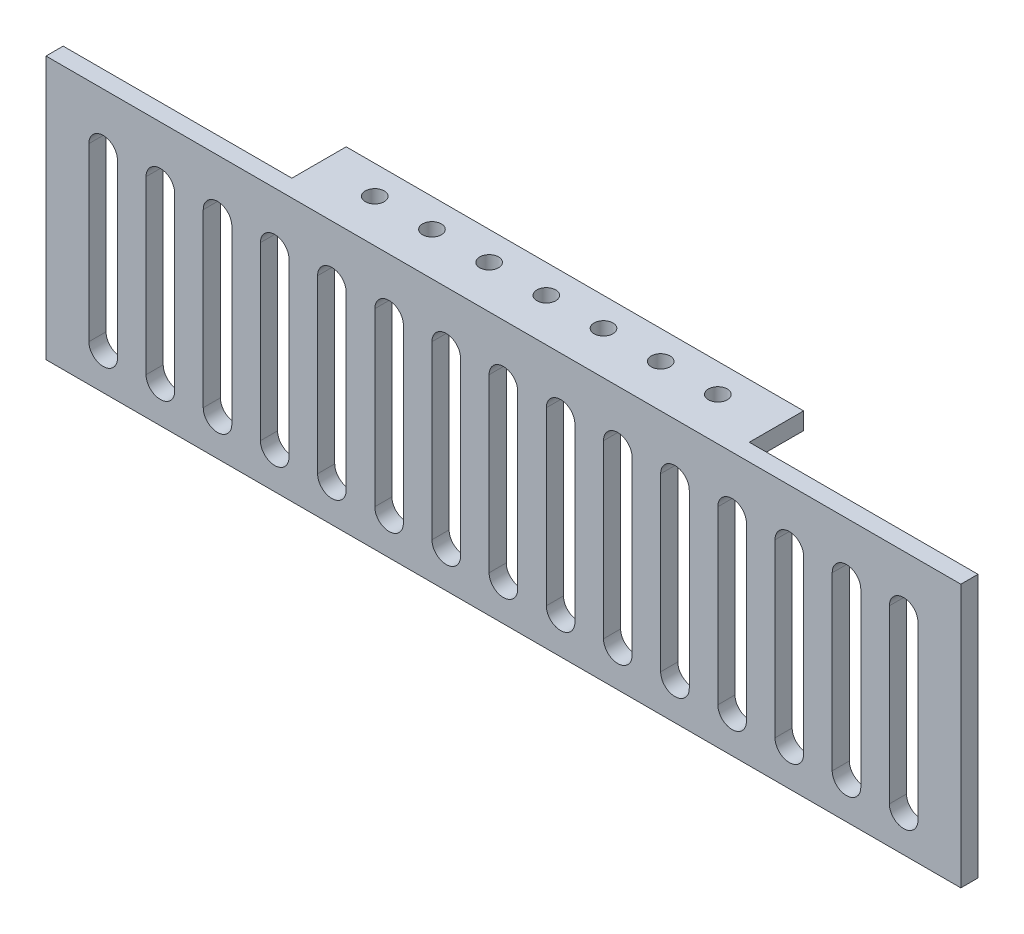
from build123d import *

# Parameters (mm, degrees)
SKETCH_1_W          = 80
SKETCH_1_H          = 15
EXTRUDE_1_DEPTH     = 3
SKETCH_2_R          = 1.65
CUT_EXTRUDE_1_DEPTH = 3
SKETCH_3_W          = 80
SKETCH_3_H          = 3
EXTRUDE_2_DEPTH     = 43
SKETCH_4_W          = 3
SKETCH_4_H          = 46
EXTRUDE_3_DEPTH     = 40
SKETCH_5_W          = 3
SKETCH_5_H          = 46
EXTRUDE_4_DEPTH     = 40
SKETCH_8_W          = 2.5
SKETCH_8_H          = 3
CUT_EXTRUDE_3_DEPTH = 80
CUT_EXTRUDE_4_DEPTH = 80


with BuildPart() as part:
    # 草图1 → 凸台-拉伸1 (new body)
    with BuildSketch(Plane(origin=(0, 0, 0), x_dir=(1, 0, 0), z_dir=(0, 1, 0))):
        Rectangle(SKETCH_1_W, SKETCH_1_H)
    extrude(amount=EXTRUDE_1_DEPTH)

    # 草图2 → 切除-拉伸1 (cut)
    with BuildSketch(Plane(origin=(0, 3, 0), x_dir=(1, 0, 0), z_dir=(0, 1, 0))):
        with Locations(Location((-30, 2.5, 0), (0, 0, 270))):
            Circle(SKETCH_2_R)
        with Locations(Location((-20, 2.5, 0), (0, 0, 270))):
            Circle(SKETCH_2_R)
        with Locations(Location((-10, 2.5, 0), (0, 0, 270))):
            Circle(SKETCH_2_R)
        with Locations(Location((0, 2.5, 0), (0, 0, 270))):
            Circle(SKETCH_2_R)
        with Locations(Location((10, 2.5, 0), (0, 0, 270))):
            Circle(SKETCH_2_R)
        with Locations(Location((20, 2.5, 0), (0, 0, 270))):
            Circle(SKETCH_2_R)
        with Locations(Location((30, 2.5, 0), (0, 0, 270))):
            Circle(SKETCH_2_R)
    extrude(amount=-CUT_EXTRUDE_1_DEPTH, mode=Mode.SUBTRACT)

    # 草图3 → 凸台-拉伸2 (add)
    with BuildSketch(Plane.XZ):
        with Locations((0, 3.5)):
            Rectangle(SKETCH_3_W, SKETCH_3_H)
    extrude(amount=EXTRUDE_2_DEPTH)

    # 草图4 → 凸台-拉伸3 (add)
    with BuildSketch(Plane(origin=(40, 0, 0), x_dir=(0, 0, -1), z_dir=(1, 0, 0))):
        with Locations((-3.5, -20)):
            Rectangle(SKETCH_4_W, SKETCH_4_H)
    extrude(amount=EXTRUDE_3_DEPTH)

    # 草图5 → 凸台-拉伸4 (add)
    with BuildSketch(Plane.ZY.offset(40)):
        with Locations((3.5, -20)):
            Rectangle(SKETCH_5_W, SKETCH_5_H)
    extrude(amount=EXTRUDE_4_DEPTH)

    # 草图8 → 切除-拉伸3 (cut)
    with BuildSketch(Plane.ZY.offset(40)):
        with Locations((6.25, 1.5)):
            Rectangle(SKETCH_8_W, SKETCH_8_H)
    extrude(amount=-CUT_EXTRUDE_3_DEPTH, mode=Mode.SUBTRACT)

    # 草图9 → 切除-拉伸4 (cut)
    with BuildSketch(Plane(origin=(0, 0, 2), x_dir=(-1, 0, 0), z_dir=(0, 0, -1))):
        with BuildLine():
            Line((-67.5, -6.520841628), (-67.5, -36.520841628))
            ThreePointArc((-67.5, -36.520841628), (-70, -39.020841628), (-72.5, -36.520841628))
            Line((-72.5, -36.520841628), (-72.5, -6.520841628))
            ThreePointArc((-72.5, -6.520841628), (-70, -4.020841628), (-67.5, -6.520841628))
        make_face()
        with BuildLine():
            Line((-57.5, -6.520841628), (-57.5, -36.520841628))
            ThreePointArc((-57.5, -36.520841628), (-60, -39.020841628), (-62.5, -36.520841628))
            Line((-62.5, -36.520841628), (-62.5, -6.520841628))
            ThreePointArc((-62.5, -6.520841628), (-60, -4.020841628), (-57.5, -6.520841628))
        make_face()
        with BuildLine():
            Line((-47.5, -6.520841628), (-47.5, -36.520841628))
            ThreePointArc((-47.5, -36.520841628), (-50, -39.020841628), (-52.5, -36.520841628))
            Line((-52.5, -36.520841628), (-52.5, -6.520841628))
            ThreePointArc((-52.5, -6.520841628), (-50, -4.020841628), (-47.5, -6.520841628))
        make_face()
        with BuildLine():
            Line((-37.5, -6.520841628), (-37.5, -36.520841628))
            ThreePointArc((-37.5, -36.520841628), (-40, -39.020841628), (-42.5, -36.520841628))
            Line((-42.5, -36.520841628), (-42.5, -6.520841628))
            ThreePointArc((-42.5, -6.520841628), (-40, -4.020841628), (-37.5, -6.520841628))
        make_face()
        with BuildLine():
            Line((-27.5, -6.520841628), (-27.5, -36.520841628))
            ThreePointArc((-27.5, -36.520841628), (-30, -39.020841628), (-32.5, -36.520841628))
            Line((-32.5, -36.520841628), (-32.5, -6.520841628))
            ThreePointArc((-32.5, -6.520841628), (-30, -4.020841628), (-27.5, -6.520841628))
        make_face()
        with BuildLine():
            Line((-17.5, -6.520841628), (-17.5, -36.520841628))
            ThreePointArc((-17.5, -36.520841628), (-20, -39.020841628), (-22.5, -36.520841628))
            Line((-22.5, -36.520841628), (-22.5, -6.520841628))
            ThreePointArc((-22.5, -6.520841628), (-20, -4.020841628), (-17.5, -6.520841628))
        make_face()
        with BuildLine():
            Line((-7.5, -6.520841628), (-7.5, -36.520841628))
            ThreePointArc((-7.5, -36.520841628), (-10, -39.020841628), (-12.5, -36.520841628))
            Line((-12.5, -36.520841628), (-12.5, -6.520841628))
            ThreePointArc((-12.5, -6.520841628), (-10, -4.020841628), (-7.5, -6.520841628))
        make_face()
        with BuildLine():
            Line((2.5, -6.520841628), (2.5, -36.520841628))
            ThreePointArc((2.5, -36.520841628), (0, -39.020841628), (-2.5, -36.520841628))
            Line((-2.5, -36.520841628), (-2.5, -6.520841628))
            ThreePointArc((-2.5, -6.520841628), (0, -4.020841628), (2.5, -6.520841628))
        make_face()
        with BuildLine():
            Line((12.5, -6.520841628), (12.5, -36.520841628))
            ThreePointArc((12.5, -36.520841628), (10, -39.020841628), (7.5, -36.520841628))
            Line((7.5, -36.520841628), (7.5, -6.520841628))
            ThreePointArc((7.5, -6.520841628), (10, -4.020841628), (12.5, -6.520841628))
        make_face()
        with BuildLine():
            Line((22.5, -6.520841628), (22.5, -36.520841628))
            ThreePointArc((22.5, -36.520841628), (20, -39.020841628), (17.5, -36.520841628))
            Line((17.5, -36.520841628), (17.5, -6.520841628))
            ThreePointArc((17.5, -6.520841628), (20, -4.020841628), (22.5, -6.520841628))
        make_face()
        with BuildLine():
            Line((32.5, -6.520841628), (32.5, -36.520841628))
            ThreePointArc((32.5, -36.520841628), (30, -39.020841628), (27.5, -36.520841628))
            Line((27.5, -36.520841628), (27.5, -6.520841628))
            ThreePointArc((27.5, -6.520841628), (30, -4.020841628), (32.5, -6.520841628))
        make_face()
        with BuildLine():
            Line((42.5, -6.520841628), (42.5, -36.520841628))
            ThreePointArc((42.5, -36.520841628), (40, -39.020841628), (37.5, -36.520841628))
            Line((37.5, -36.520841628), (37.5, -6.520841628))
            ThreePointArc((37.5, -6.520841628), (40, -4.020841628), (42.5, -6.520841628))
        make_face()
        with BuildLine():
            Line((52.5, -6.520841628), (52.5, -36.520841628))
            ThreePointArc((52.5, -36.520841628), (50, -39.020841628), (47.5, -36.520841628))
            Line((47.5, -36.520841628), (47.5, -6.520841628))
            ThreePointArc((47.5, -6.520841628), (50, -4.020841628), (52.5, -6.520841628))
        make_face()
        with BuildLine():
            Line((62.5, -6.520841628), (62.5, -36.520841628))
            ThreePointArc((62.5, -36.520841628), (60, -39.020841628), (57.5, -36.520841628))
            Line((57.5, -36.520841628), (57.5, -6.520841628))
            ThreePointArc((57.5, -6.520841628), (60, -4.020841628), (62.5, -6.520841628))
        make_face()
        with BuildLine():
            Line((72.5, -6.520841628), (72.5, -36.520841628))
            ThreePointArc((72.5, -36.520841628), (70, -39.020841628), (67.5, -36.520841628))
            Line((67.5, -36.520841628), (67.5, -6.520841628))
            ThreePointArc((67.5, -6.520841628), (70, -4.020841628), (72.5, -6.520841628))
        make_face()
    extrude(amount=-CUT_EXTRUDE_4_DEPTH, mode=Mode.SUBTRACT)


solid = part.part
